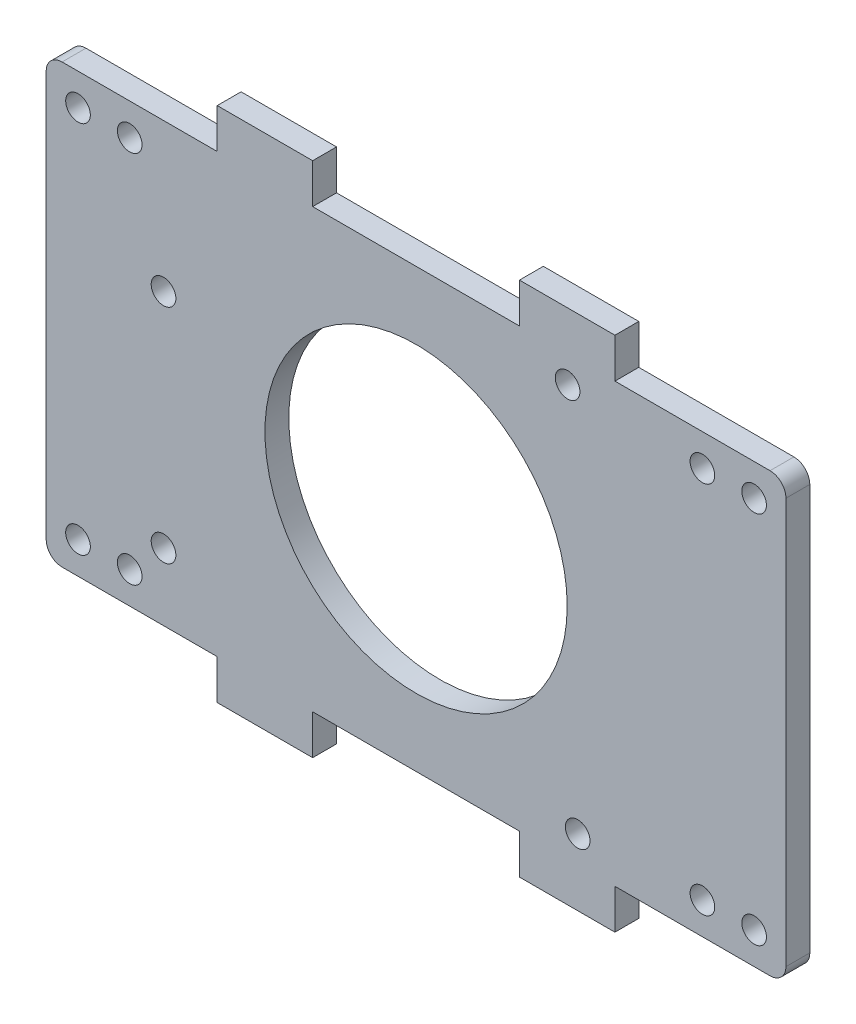
from build123d import *

# Parameters (mm, degrees)
ESQUISSE1_R        = 19
ESQUISSE1_R_2      = 1.55
BOSS_EXTRU_1_DEPTH = 3


with BuildPart() as part:
    # Esquisse1 → Boss.-Extru.1 (new body)
    with BuildSketch(Plane.XY):
        with BuildLine():
            Line((-25, -32.5), (-25, -27.5))
            Line((-25, -27.5), (-44.5, -27.5))
            ThreePointArc((-44.5, -27.5), (-45.914213562, -26.914213562), (-46.5, -25.5))
            Line((-46.5, -25.5), (-46.5, 25.5))
            ThreePointArc((-46.5, 25.5), (-45.914213562, 26.914213562), (-44.5, 27.5))
            Line((-44.5, 27.5), (-25, 27.5))
            Line((-25, 27.5), (-25, 32.5))
            Line((-25, 32.5), (-13, 32.5))
            Line((-13, 32.5), (-13, 27.5))
            Line((-13, 27.5), (13, 27.5))
            Line((13, 27.5), (13, 32.5))
            Line((13, 32.5), (25, 32.5))
            Line((25, 32.5), (25, 27.5))
            Line((25, 27.5), (44.5, 27.5))
            ThreePointArc((44.5, 27.5), (45.914213562, 26.914213562), (46.5, 25.5))
            Line((46.5, 25.5), (46.5, -25.5))
            ThreePointArc((46.5, -25.5), (45.914213562, -26.914213562), (44.5, -27.5))
            Line((44.5, -27.5), (25, -27.5))
            Line((25, -27.5), (25, -32.5))
            Line((25, -32.5), (13, -32.5))
            Line((13, -32.5), (13, -27.5))
            Line((13, -27.5), (-13, -27.5))
            Line((-13, -27.5), (-13, -32.5))
            Line((-13, -32.5), (-25, -32.5))
        make_face()
        Circle(ESQUISSE1_R, mode=Mode.SUBTRACT)
        with Locations((-42.5, 23.5)):
            Circle(ESQUISSE1_R_2, mode=Mode.SUBTRACT)
        with Locations((-36, 23.5)):
            Circle(ESQUISSE1_R_2, mode=Mode.SUBTRACT)
        with Locations((-31.75, 8.89)):
            Circle(ESQUISSE1_R_2, mode=Mode.SUBTRACT)
        with Locations((-31.75, -19.05)):
            Circle(ESQUISSE1_R_2, mode=Mode.SUBTRACT)
        with Locations((-36, -23.5)):
            Circle(ESQUISSE1_R_2, mode=Mode.SUBTRACT)
        with Locations((-42.5, -23.5)):
            Circle(ESQUISSE1_R_2, mode=Mode.SUBTRACT)
        with Locations((19.05, 24.13)):
            Circle(ESQUISSE1_R_2, mode=Mode.SUBTRACT)
        with Locations((36, 23.5)):
            Circle(ESQUISSE1_R_2, mode=Mode.SUBTRACT)
        with Locations((42.5, 23.5)):
            Circle(ESQUISSE1_R_2, mode=Mode.SUBTRACT)
        with Locations((42.5, -23.5)):
            Circle(ESQUISSE1_R_2, mode=Mode.SUBTRACT)
        with Locations((36, -23.5)):
            Circle(ESQUISSE1_R_2, mode=Mode.SUBTRACT)
        with Locations((20.32, -24.13)):
            Circle(ESQUISSE1_R_2, mode=Mode.SUBTRACT)
    extrude(amount=BOSS_EXTRU_1_DEPTH)


solid = part.part
